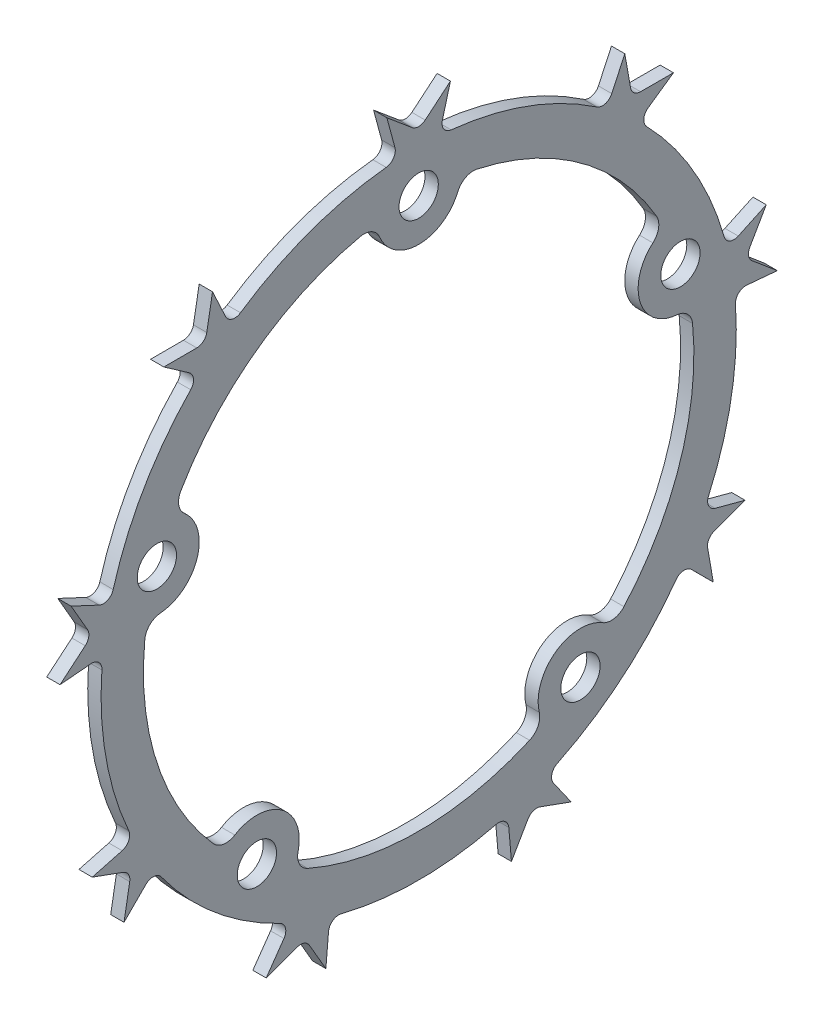
from build123d import *

# Parameters (mm, degrees)
SKETCH1_R                = 23.8125
SKETCH1_R_2              = 20.6375
BOSS_EXTRUDE1_DEPTH      = 1.000000032
BOSS_EXTRUDE2_START      = -1.000000032
BOSS_EXTRUDE2_DEPTH      = 1.000000032
FILLET1_R                = 0.762
CIRPATTERN1_COUNT        = 9
FILLET1_OF_CIRPATTERN1_R = 0.762
SKETCH3_R                = 3.175
BOSS_EXTRUDE3_DEPTH      = 1.000000032
FILLET2_R                = 1.27
F_4_CLEARANCE_HOLE1_D    = 2.9464
CIRPATTERN2_COUNT        = 5
FILLET2_OF_CIRPATTERN2_R = 1.27


with BuildPart() as part:
    # Sketch1 → Boss-Extrude1 (new body)
    with BuildSketch(Plane(origin=(0, 0, 0), x_dir=(0, 0, -1), z_dir=(1, 0, 0))):
        Circle(SKETCH1_R)
        Circle(SKETCH1_R_2, mode=Mode.SUBTRACT)
    extrude(amount=BOSS_EXTRUDE1_DEPTH)

    # Sketch2 → Boss-Extrude2 (add)
    with BuildSketch(Plane(origin=(1.000000032, 0, 0), x_dir=(0, 0, -1), z_dir=(1, 0, 0)).offset(BOSS_EXTRUDE2_START)):
        with BuildLine():
            Line((1.541704306, 23.762539933), (2.38125, 26.882239577))
            Line((2.38125, 26.882239577), (0, 24.888527198))
            Line((0, 24.888527198), (-2.38125, 26.882239577))
            Line((-2.38125, 26.882239577), (-1.541704306, 23.762539933))
            ThreePointArc((-1.541704306, 23.762539933), (0, 23.8125), (1.541704306, 23.762539933))
        make_face()
    boss_extrude2 = extrude(amount=BOSS_EXTRUDE2_DEPTH)

    # Fillet1
    fillet1_edges = [part.edges().sort_by_distance(p)[0] for p in [
        (0.500000016, 23.762539933, -1.541704306),
        (0.500000016, 23.762539933, 1.541704306),
        (0.500000016, 24.888527198, 0),
    ]]
    fillet(fillet1_edges, radius=FILLET1_R)

    # CirPattern1: Boss-Extrude2 ×9 about axis
    cirpattern1_axis = Axis((0, 0, 0), (1, 0, 0))
    for i in range(1, CIRPATTERN1_COUNT):
        add(boss_extrude2.rotate(cirpattern1_axis, i * 360 / CIRPATTERN1_COUNT))

    # Fillet1 of CirPattern1
    fillet1_of_cirpattern1_edges = [part.edges().sort_by_distance(p)[0] for p in [
        (0.500000016, 19.194150096, 14.093252227),
        (0.500000016, 17.212173244, 16.455280261),
        (0.500000016, 19.065717957, 15.998036906),
        (0.500000016, 5.64460411, 23.133819414),
        (0.500000016, 2.608039402, 23.669247701),
        (0.500000016, 4.321847393, 24.510414546),
        (0.500000016, -10.546114872, 21.349815394),
        (0.500000016, -13.216425061, 19.808111088),
        (0.500000016, -12.444263599, 21.554096816),
        (0.500000016, -21.802189499, 9.575995474),
        (0.500000016, -22.856777354, 6.678539154),
        (0.500000016, -23.38756535, 8.512377639),
        (0.500000016, -22.856777354, -6.678539154),
        (0.500000016, -21.802189499, -9.575995474),
        (0.500000016, -23.38756535, -8.512377639),
        (0.500000016, -13.216425061, -19.808111088),
        (0.500000016, -10.546114872, -21.349815394),
        (0.500000016, -12.444263599, -21.554096816),
        (0.500000016, 2.608039402, -23.669247701),
        (0.500000016, 5.64460411, -23.133819414),
        (0.500000016, 4.321847393, -24.510414546),
        (0.500000016, 17.212173244, -16.455280261),
        (0.500000016, 19.194150096, -14.093252227),
        (0.500000016, 19.065717957, -15.998036906),
    ]]
    fillet(fillet1_of_cirpattern1_edges, radius=FILLET1_OF_CIRPATTERN1_R)

    # Sketch3 → Boss-Extrude3 (add)
    with BuildSketch(Plane(origin=(1.000000032, 0, 0), x_dir=(0, 0, -1), z_dir=(1, 0, 0))):
        with Locations((0, 20.6375)):
            Circle(SKETCH3_R)
    boss_extrude3 = extrude(amount=-BOSS_EXTRUDE3_DEPTH)

    # Fillet2
    fillet2_edges = [part.edges().sort_by_distance(p)[0] for p in [
        (0.500000016, 20.393269231, 3.165592572),
        (0.500000016, 20.393269231, -3.165592572),
    ]]
    fillet(fillet2_edges, radius=FILLET2_R)

    # #4 Clearance Hole1 (through all)
    with Locations(Plane(origin=(1.000000032, 0, 0), x_dir=(0, 0, -1), z_dir=(1, 0, 0))):
        with Locations((0, 20.6375)):
            f_4_clearance_hole1 = Hole(F_4_CLEARANCE_HOLE1_D / 2)

    # CirPattern2: Boss-Extrude3, #4 Clearance Hole1 ×5 about axis
    cirpattern2_axis = Axis((0, 0, 0), (1, 0, 0))
    add([boss_extrude3.rotate(cirpattern2_axis, i * 360 / CIRPATTERN2_COUNT) for i in range(1, CIRPATTERN2_COUNT)])
    add([f_4_clearance_hole1.rotate(cirpattern2_axis, i * 360 / CIRPATTERN2_COUNT) for i in range(1, CIRPATTERN2_COUNT)], mode=Mode.SUBTRACT)

    # Fillet2 of CirPattern2
    fillet2_of_cirpattern2_edges = [part.edges().sort_by_distance(p)[0] for p in [
        (0.500000016, 3.29120932, 20.373373492),
        (0.500000016, 9.312524207, 18.416929688),
        (0.500000016, -18.359190007, 9.425844712),
        (0.500000016, -14.63781275, 14.547881088),
        (0.500000016, -14.63781275, -14.547881088),
        (0.500000016, -18.359190007, -9.425844712),
        (0.500000016, 9.312524207, -18.416929688),
        (0.500000016, 3.29120932, -20.373373492),
    ]]
    fillet(fillet2_of_cirpattern2_edges, radius=FILLET2_OF_CIRPATTERN2_R)


solid = part.part
